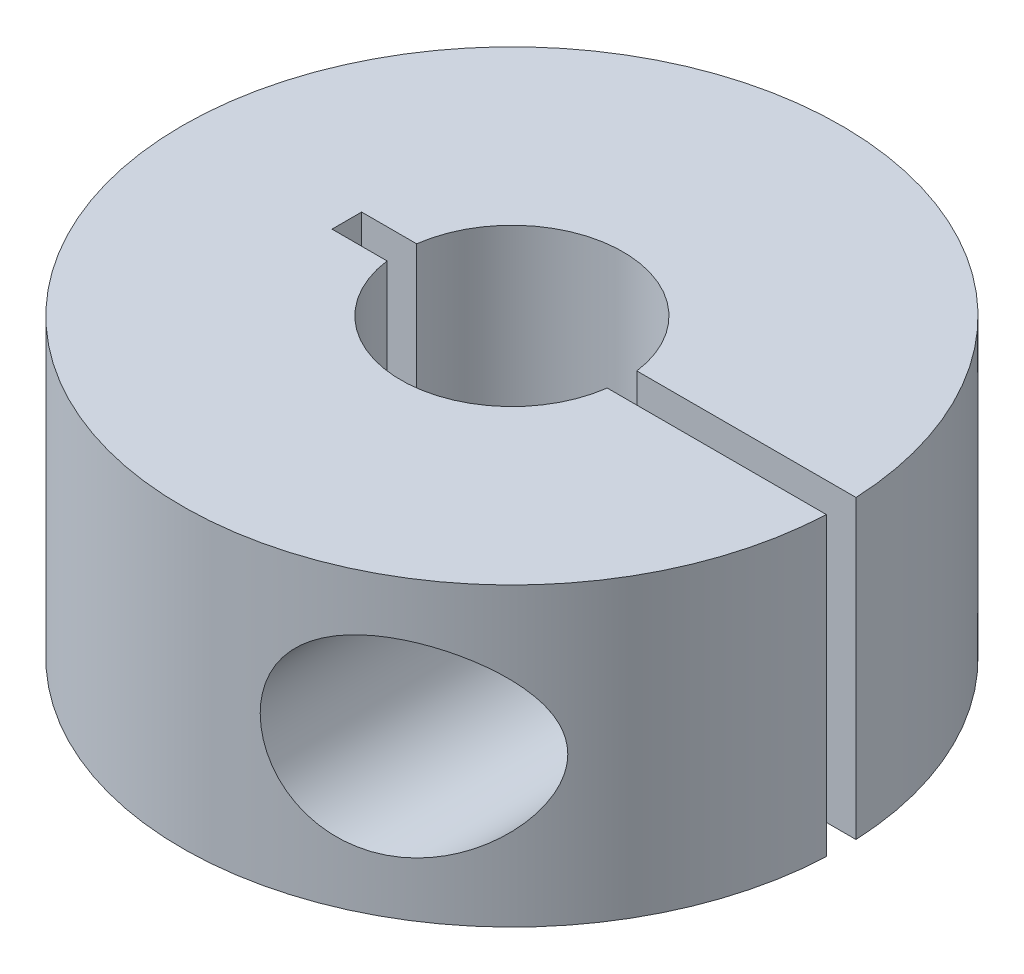
from build123d import *

# Parameters (mm, degrees)
SKETCH1_R               = 11.125
BOSS_EXTRUDE1_DEPTH     = 10
CUT_EXTRUDE1_DEPTH      = 21.573800087
SKETCH3_W               = 17
SKETCH3_H               = 1
CUT_EXTRUDE2_DEPTH      = 19.642190054
SKETCH8_R               = 3.19
CUT_EXTRUDE3_DEPTH      = 22.703484743
CUT_EXTRUDE4_DEPTH      = 19.642190227
CUT_EXTRUDE4_DEPTH_BACK = 19.642190227
SKETCH9_R               = 3.75


with BuildPart() as part:
    # Sketch1 → Boss-Extrude1 (new body)
    with BuildSketch(Plane(origin=(0, 0, 0), x_dir=(1, 0, 0), z_dir=(0, 1, 0))):
        Circle(SKETCH1_R)
    extrude(amount=BOSS_EXTRUDE1_DEPTH)

    # Sketch2 → Cut-Extrude1 (cut, through all)
    with BuildSketch(Plane.XY.offset(-3)):
        Polygon((4.358109394, 2.895375742), (6.78296277, 2.90465501), (7.987353376, 5.009279269), (6.766890606, 7.104624258), (4.34203723, 7.09534499), (3.137646624, 4.990720731), align=None)
    extrude(amount=-CUT_EXTRUDE1_DEPTH, mode=Mode.SUBTRACT)

    # Sketch3 → Cut-Extrude2 (cut, through all)
    with BuildSketch(Plane(origin=(0, 0, 0), x_dir=(1, 0, 0), z_dir=(0, 1, 0))):
        with Locations((2.926474536, 0)):
            Rectangle(SKETCH3_W, SKETCH3_H)
    extrude(amount=CUT_EXTRUDE2_DEPTH, mode=Mode.SUBTRACT)

    # Sketch7 → CBORE for M2 Hex Head Machine Screw1 (revolve, cut)
    with BuildSketch(Plane(origin=(5.5625, 5, 4.6), x_dir=(0, -1, 0), z_dir=(1, 0, 0))):
        Polygon((0, 0), (0, 15.725), (1.2, 15.725), (1.2, 1.6), (3.19, 1.6), (3.19, 0), align=None)
    revolve(axis=Axis((5.5625, 5, 10.95), (0, 0, -1)), mode=Mode.SUBTRACT)

    # Sketch8 → Cut-Extrude3 (cut, through all)
    with BuildSketch(Plane.XY.offset(4.6)):
        with Locations((5.5625, 5)):
            Circle(SKETCH8_R)
    extrude(amount=CUT_EXTRUDE3_DEPTH, mode=Mode.SUBTRACT)

    # Sketch9 → Cut-Extrude4 (cut, two sides: drawn at the far end of the back side and taken through both)
    with BuildSketch(Plane(origin=(0, 0, 0), x_dir=(1, 0, 0), z_dir=(0, 1, 0)).offset(-CUT_EXTRUDE4_DEPTH_BACK)):
        Circle(SKETCH9_R)
    extrude(amount=CUT_EXTRUDE4_DEPTH + CUT_EXTRUDE4_DEPTH_BACK, mode=Mode.SUBTRACT)


solid = part.part
